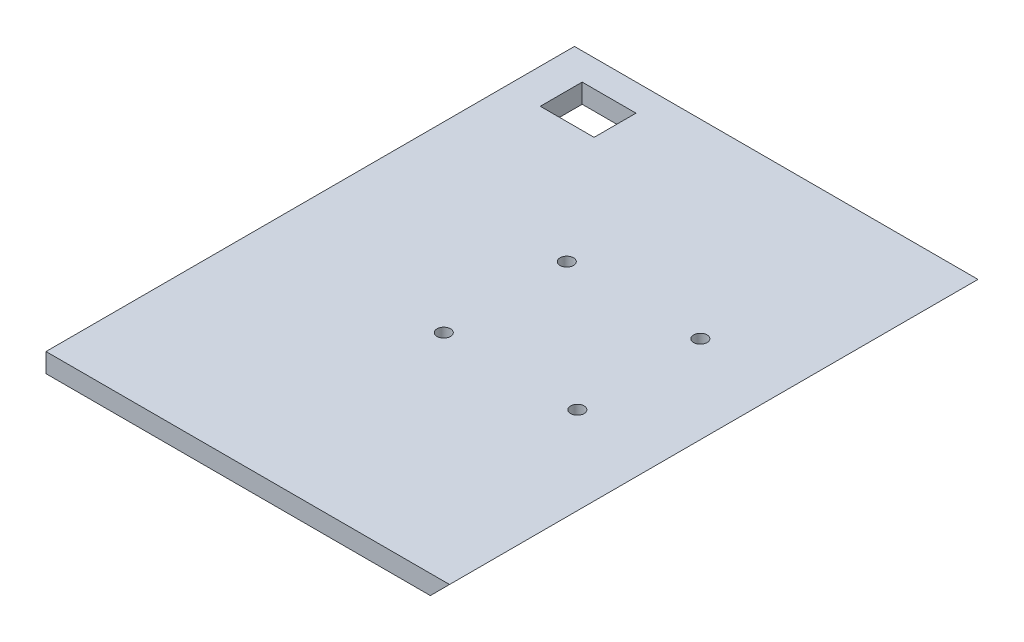
from build123d import *

# Parameters (mm, degrees)
IZIM1_W                     = 275
IZIM1_H                     = 10
Y_KSEKLIK_EKSTR_ZYON1_DEPTH = 200
IZIM2_W                     = 275
IZIM2_H                     = 10
Y_KSEKLIK_EKSTR_ZYON2_DEPTH = 10
KES_EKSTR_ZYON1_DEPTH       = 347.157478613
CUT_EXTRUDE1_REACH          = 348.157
SKETCH1_R                   = 3.5
SKETCH2_W                   = 28
SKETCH2_H                   = 21.8
CUT_EXTRUDE2_DEPTH          = 10


with BuildPart() as part:
    # Çizim1 → Yükseklik-Ekstrüzyon1 (new body)
    with BuildSketch(Plane(origin=(0, 0, 0), x_dir=(0, 0, -1), z_dir=(1, 0, 0))):
        with Locations((137.5, 5)):
            Rectangle(IZIM1_W, IZIM1_H)
    extrude(amount=Y_KSEKLIK_EKSTR_ZYON1_DEPTH)

    # Çizim2 → Yükseklik-Ekstrüzyon2 (add)
    with BuildSketch(Plane(origin=(200, 0, 0), x_dir=(0, 0, -1), z_dir=(1, 0, 0))):
        with Locations((137.5, 5)):
            Rectangle(IZIM2_W, IZIM2_H)
    extrude(amount=Y_KSEKLIK_EKSTR_ZYON2_DEPTH)

    # Çizim3 → Kes-Ekstrüzyon1 (cut, through all)
    with BuildSketch(Plane(origin=(0, 0, -275), x_dir=(-1, 0, 0), z_dir=(0, 0, -1))):
        Polygon((-210, 10), (-200, 0), (-210, 0), align=None)
    extrude(amount=-KES_EKSTR_ZYON1_DEPTH, mode=Mode.SUBTRACT)

    # Sketch1 → Cut-Extrude1 (cut, up to next)
    with BuildSketch(Plane(origin=(0, 10, 0), x_dir=(1, 0, 0), z_dir=(0, 1, 0)), mode=Mode.PRIVATE) as cut_extrude1_sk1:
        with Locations(Location((95, 176.01, 0), (0, 0, 270))):
            Circle(SKETCH1_R)
    cut_extrude1_tool1 = extrude(cut_extrude1_sk1.sketch, amount=-CUT_EXTRUDE1_REACH, mode=Mode.PRIVATE) & part.part
    # Sketch1 → Cut-Extrude1 (cut, up to next)
    with BuildSketch(Plane(origin=(0, 10, 0), x_dir=(1, 0, 0), z_dir=(0, 1, 0)), mode=Mode.PRIVATE) as cut_extrude1_sk2:
        with Locations(Location((164.5, 176.01, 0), (0, 0, 270))):
            Circle(SKETCH1_R)
    cut_extrude1_tool2 = extrude(cut_extrude1_sk2.sketch, amount=-CUT_EXTRUDE1_REACH, mode=Mode.PRIVATE) & part.part
    # Sketch1 → Cut-Extrude1 (cut, up to next)
    with BuildSketch(Plane(origin=(0, 10, 0), x_dir=(1, 0, 0), z_dir=(0, 1, 0)), mode=Mode.PRIVATE) as cut_extrude1_sk3:
        with Locations(Location((95, 112.01, 0), (0, 0, 270))):
            Circle(SKETCH1_R)
    cut_extrude1_tool3 = extrude(cut_extrude1_sk3.sketch, amount=-CUT_EXTRUDE1_REACH, mode=Mode.PRIVATE) & part.part
    # Sketch1 → Cut-Extrude1 (cut, up to next)
    with BuildSketch(Plane(origin=(0, 10, 0), x_dir=(1, 0, 0), z_dir=(0, 1, 0)), mode=Mode.PRIVATE) as cut_extrude1_sk4:
        with Locations(Location((164.5, 112.01, 0), (0, 0, 270))):
            Circle(SKETCH1_R)
    cut_extrude1_tool4 = extrude(cut_extrude1_sk4.sketch, amount=-CUT_EXTRUDE1_REACH, mode=Mode.PRIVATE) & part.part
    add(cut_extrude1_tool1.solids().sort_by_distance((95, 10, -176.01))[0], mode=Mode.SUBTRACT)
    add(cut_extrude1_tool2.solids().sort_by_distance((164.5, 10, -176.01))[0], mode=Mode.SUBTRACT)
    add(cut_extrude1_tool3.solids().sort_by_distance((95, 10, -112.01))[0], mode=Mode.SUBTRACT)
    add(cut_extrude1_tool4.solids().sort_by_distance((164.5, 10, -112.01))[0], mode=Mode.SUBTRACT)

    # Sketch2 → Cut-Extrude2 (cut)
    with BuildSketch(Plane(origin=(0, 10, 0), x_dir=(1, 0, 0), z_dir=(0, 1, 0))):
        with Locations((32.090687836, 250.029608882)):
            Rectangle(SKETCH2_W, SKETCH2_H)
    extrude(amount=-CUT_EXTRUDE2_DEPTH, mode=Mode.SUBTRACT)


solid = part.part
